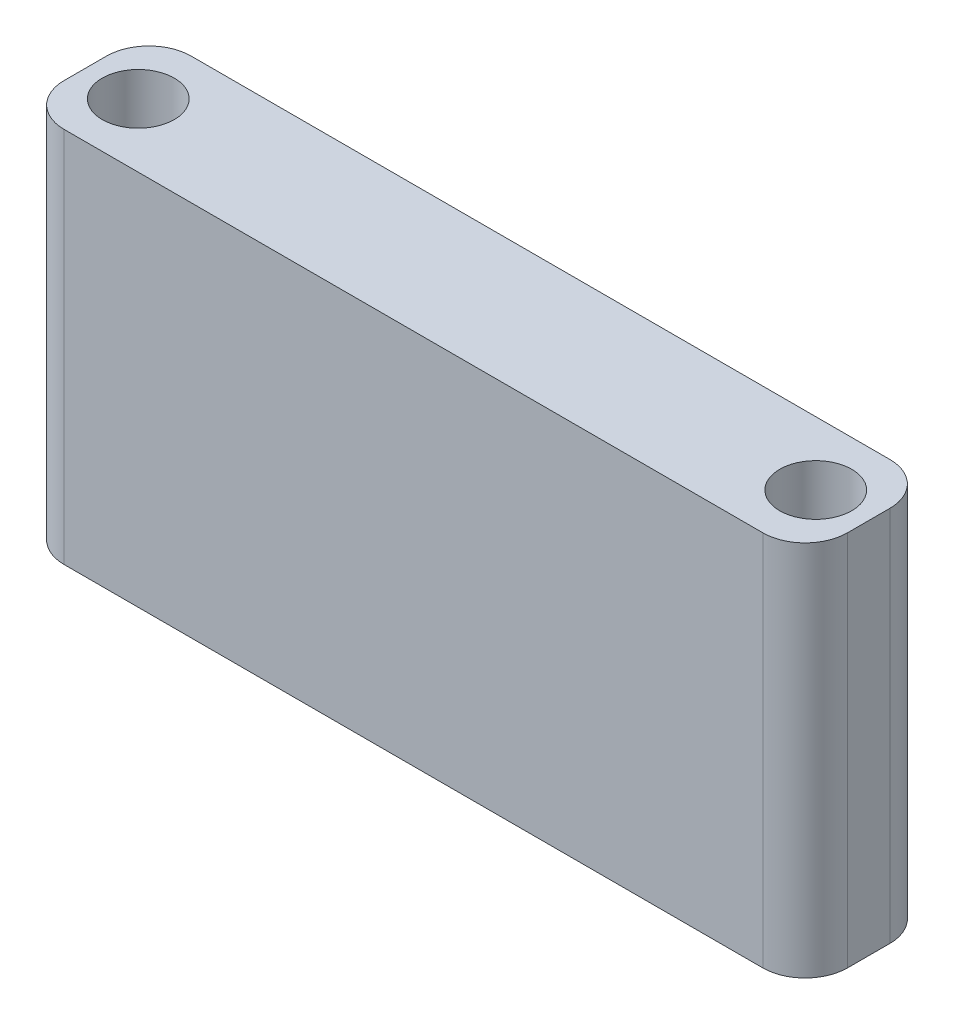
from build123d import *

# Parameters (mm, degrees)
CROQUIS1_W              = 37
CROQUIS1_H              = 6
CROQUIS1_R              = 1.7
SALIENTE_EXTRUIR1_DEPTH = 17.8
REDONDEO1_R             = 2


with BuildPart() as part:
    # Croquis1 → Saliente-Extruir1 (new body)
    with BuildSketch(Plane(origin=(0, 0, 0), x_dir=(1, 0, 0), z_dir=(0, 1, 0))):
        with Locations((18.5, 3)):
            Rectangle(CROQUIS1_W, CROQUIS1_H)
        with Locations(Location((2.5, 3, 0), (0, 0, 270))):
            Circle(CROQUIS1_R, mode=Mode.SUBTRACT)
        with Locations(Location((34.5, 3, 0), (0, 0, 270))):
            Circle(CROQUIS1_R, mode=Mode.SUBTRACT)
    extrude(amount=SALIENTE_EXTRUIR1_DEPTH)

    # Redondeo1
    redondeo1_edges = [part.edges().sort_by_distance(p)[0] for p in [
        (0, 8.9, -6),
        (37, 8.9, -6),
        (37, 8.9, 0),
        (0, 8.9, 0),
    ]]
    fillet(redondeo1_edges, radius=REDONDEO1_R)


solid = part.part
